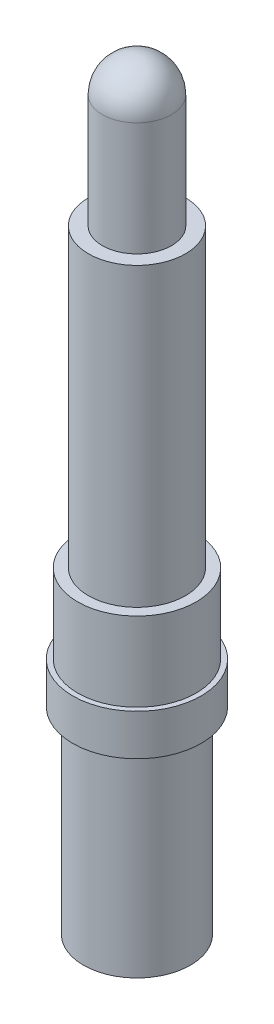
from build123d import *


with BuildPart() as part:
    # Sketch2 → Revolve1 (revolve)
    with BuildSketch(Plane.XY, mode=Mode.PRIVATE) as revolve1_sk:
        with BuildLine():
            Line((0.5334, 11.2268), (0.5334, 9.4742))
            Line((0.5334, 9.4742), (0.7493, 9.4742))
            Line((0.7493, 9.4742), (0.7493, 4.9022))
            Line((0.7493, 4.9022), (0.9144, 4.9022))
            Line((0.9144, 4.9022), (0.9144, 3.683))
            Line((0.9144, 3.683), (0.9906, 3.683))
            Line((0.9906, 3.683), (0.9906, 3.048))
            Line((0.9906, 3.048), (0.8255, 3.048))
            Line((0.8255, 3.048), (0.8255, 0))
            Line((0.8255, 0), (0, 0))
            Line((0, 0), (0, 11.7602))
            ThreePointArc((0, 11.7602), (0.377170757, 11.603970757), (0.5334, 11.2268))
        make_face()
    revolve(revolve1_sk.sketch.rotate(Axis((0, 0, 0), (0, -1, 0)), 90), axis=Axis((0, 0, 0), (0, -1, 0)))


solid = part.part
